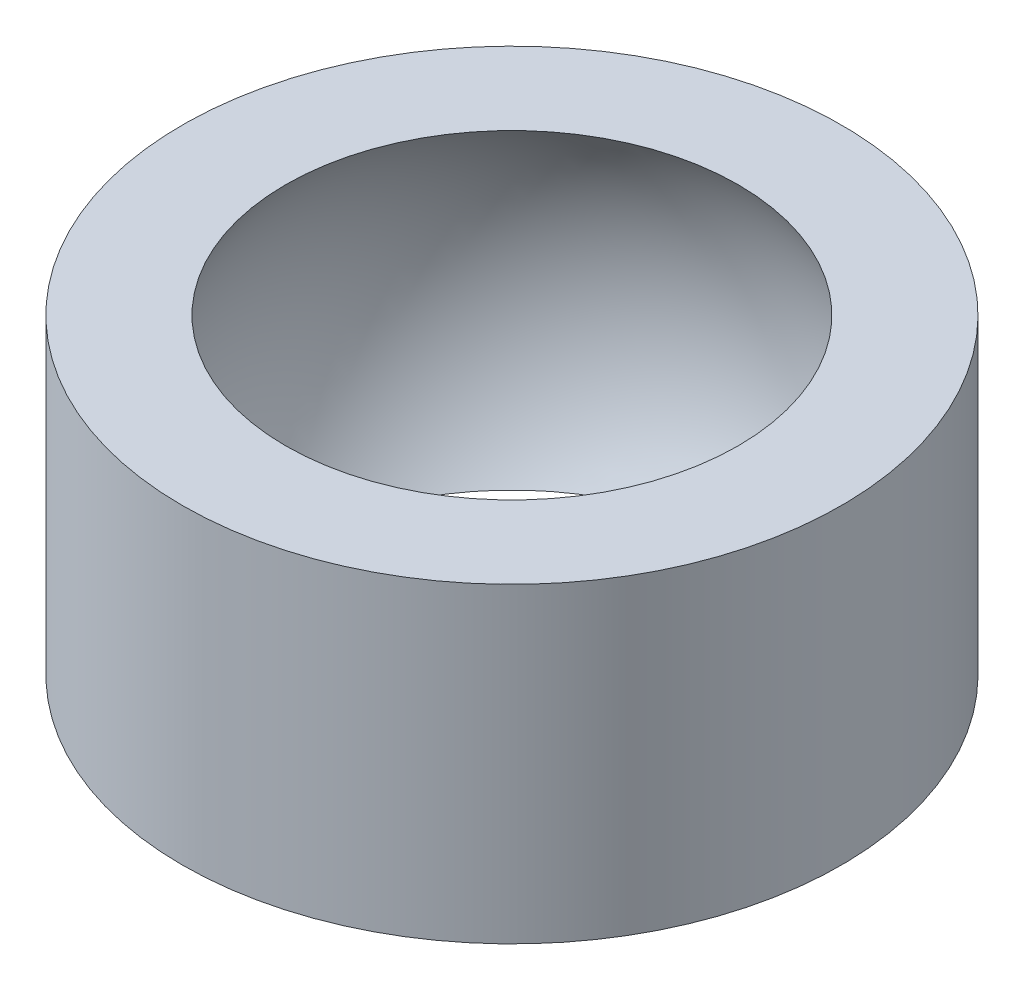
from build123d import *


with BuildPart() as part:
    # Croquis1 → Revolución1 (revolve)
    with BuildSketch(Plane.XY, mode=Mode.PRIVATE) as revoluci_n1_sk:
        with BuildLine():
            Line((9.525, 0), (9.525, 4.5))
            Line((9.525, 4.5), (6.538647127, 4.5))
            ThreePointArc((6.538647127, 4.5), (7.9375, 0), (6.538647127, -4.5))
            Line((6.538647127, -4.5), (9.525, -4.5))
            Line((9.525, -4.5), (9.525, 0))
        make_face()
    revolve(revoluci_n1_sk.sketch.rotate(Axis((0, 0, 0), (0, -1, 0)), 90), axis=Axis((0, 0, 0), (0, -1, 0)))


solid = part.part
